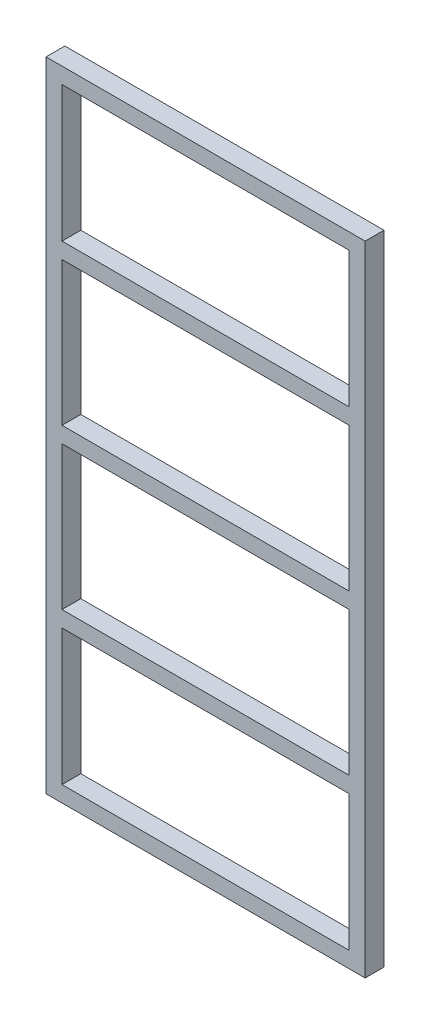
from build123d import *

# Parameters (mm, degrees)
SKETCH1_W           = 50.8
SKETCH1_H           = 101.6
SKETCH1_W_2         = 45.72
SKETCH1_H_2         = 21.59
SKETCH1_H_3         = 22.86
BOSS_EXTRUDE1_DEPTH = 3


with BuildPart() as part:
    # Sketch1 → Boss-Extrude1 (new body)
    with BuildSketch(Plane.XY):
        Rectangle(SKETCH1_W, SKETCH1_H)
        with Locations((0, 37.465)):
            Rectangle(SKETCH1_W_2, SKETCH1_H_2, mode=Mode.SUBTRACT)
        with Locations((0, -37.465)):
            Rectangle(SKETCH1_W_2, SKETCH1_H_2, mode=Mode.SUBTRACT)
        with Locations((0, 12.7)):
            Rectangle(SKETCH1_W_2, SKETCH1_H_3, mode=Mode.SUBTRACT)
        with Locations((0, -12.7)):
            Rectangle(SKETCH1_W_2, SKETCH1_H_3, mode=Mode.SUBTRACT)
    extrude(amount=BOSS_EXTRUDE1_DEPTH)


solid = part.part
